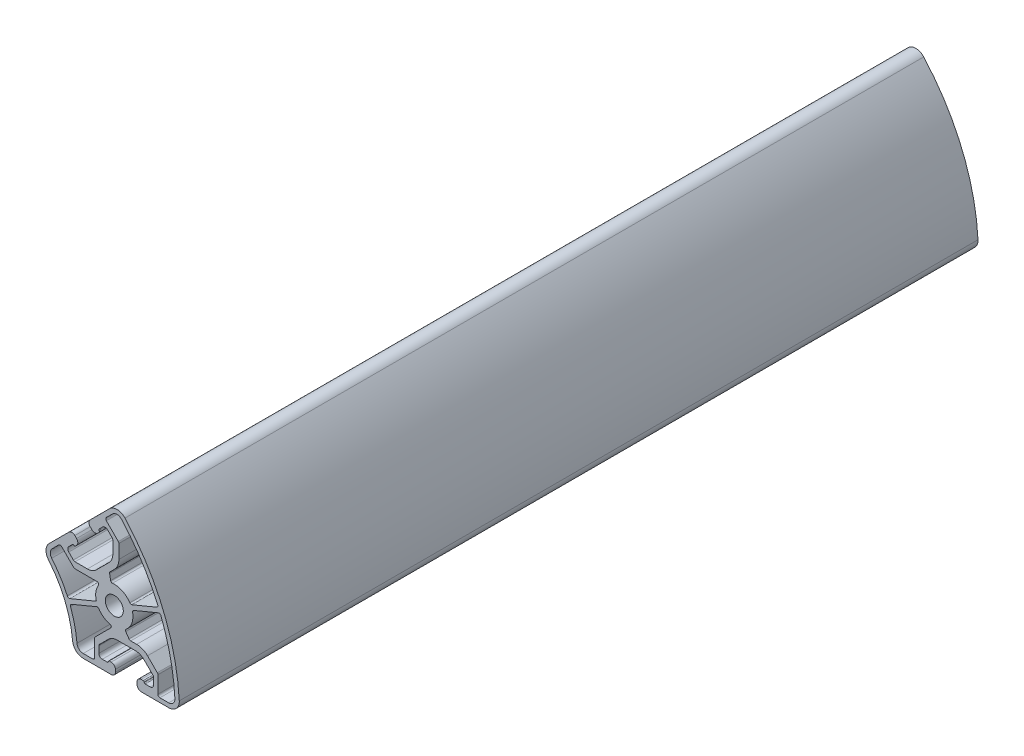
from build123d import *

# Parameters (mm, degrees)
SKETCH1_R      = 3.378193244
EXTRUDE1_DEPTH = 300


with BuildPart() as part:
    # Sketch1 → Extrude1 (new body)
    with BuildSketch(Plane.XY):
        with BuildLine():
            Line((-17.04042372, 15.431408639), (-24.485570149, 7.990664768))
            ThreePointArc((-24.485570149, 7.990664768), (-25.653755155, 5.34518984), (-24.733349861, 2.603648687))
            ThreePointArc((-24.733349861, 2.603648687), (-18.529607307, -7.672004621), (-15.653778055, -19.325548231))
            ThreePointArc((-15.653778055, -19.325548231), (-14.366806417, -21.915316136), (-11.67045068, -22.960715361))
            Line((-11.67045068, -22.960715361), (-1.144536244, -22.960715361))
            ThreePointArc((-1.144536244, -22.960715361), (-0.031123661, -22.499524769), (0.430066931, -21.386112187))
            Line((0.430066931, -21.386112187), (0.430066931, -20.471826472))
            ThreePointArc((0.430066931, -20.471826472), (-0.031123661, -19.35841389), (-1.144536244, -18.897223298))
            Line((-1.144536244, -18.897223298), (-1.851013704, -18.897223298))
            ThreePointArc((-1.851013704, -18.897223298), (-2.114950893, -19.003860844), (-2.230734754, -19.263915653))
            Line((-2.230734754, -19.263915653), (-2.231730696, -19.292435705))
            ThreePointArc((-2.231730696, -19.292435705), (-2.347514556, -19.552490514), (-2.611451745, -19.65912806))
            Line((-2.611451745, -19.65912806), (-4.522314022, -19.65912806))
            ThreePointArc((-4.522314022, -19.65912806), (-5.420227395, -19.287200163), (-5.792155291, -18.38928679))
            Line((-5.792155291, -18.38928679), (-5.792155291, -15.94919425))
            ThreePointArc((-5.792155291, -15.94919425), (-5.724492654, -15.609031199), (-5.531805764, -15.320654889))
            Line((-5.531805764, -15.320654889), (-2.245416253, -12.034265378))
            ThreePointArc((-2.245416253, -12.034265378), (-0.704662825, -11.004766851), (1.112779762, -10.643255044))
            Line((1.112779762, -10.643255044), (7.874338227, -10.643255044))
            ThreePointArc((7.874338227, -10.643255044), (9.691780814, -11.004766851), (11.232534242, -12.034265378))
            Line((11.232534242, -12.034265378), (14.518923752, -15.320654889))
            ThreePointArc((14.518923752, -15.320654889), (14.711610642, -15.609031199), (14.77927328, -15.94919425))
            Line((14.77927328, -15.94919425), (14.77927328, -18.38928679))
            ThreePointArc((14.77927328, -18.38928679), (14.407345383, -19.287200163), (13.50943201, -19.65912806))
            Line((13.50943201, -19.65912806), (11.598569733, -19.65912806))
            ThreePointArc((11.598569733, -19.65912806), (11.334632545, -19.552490514), (11.218848684, -19.292435705))
            Line((11.218848684, -19.292435705), (11.217852742, -19.263915653))
            ThreePointArc((11.217852742, -19.263915653), (11.102068882, -19.003860844), (10.838131693, -18.897223298))
            Line((10.838131693, -18.897223298), (10.068162169, -18.897223298))
            ThreePointArc((10.068162169, -18.897223298), (8.994767984, -19.373315236), (8.557051058, -20.462921818))
            Line((8.557051058, -20.462921818), (8.557051058, -21.377207532))
            ThreePointArc((8.557051058, -21.377207532), (8.99769069, -22.469479665), (10.068162169, -22.960715361))
            Line((10.068162169, -22.960715361), (20.406917219, -22.960715361))
            ThreePointArc((20.406917219, -22.960715361), (23.309060919, -21.713452534), (24.401336641, -18.749496331))
            ThreePointArc((24.401336641, -18.749496331), (18.427837191, 7.629867689), (4.005478547, 30.511063307))
            ThreePointArc((4.005478547, 30.511063307), (1.137680997, 31.835389487), (-1.796738453, 30.666079815))
            Line((-1.796738453, 30.666079815), (-9.109504077, 23.357638469))
            ThreePointArc((-9.109504077, 23.357638469), (-9.519412208, 22.253465918), (-9.058959046, 21.169397386))
            Line((-9.058959046, 21.169397386), (-8.412652649, 20.522708582))
            ThreePointArc((-8.412652649, 20.522708582), (-7.332808217, 20.061433598), (-6.237031206, 20.483466005))
            Line((-6.237031206, 20.483466005), (-5.692419534, 21.027755629))
            ThreePointArc((-5.692419534, 21.027755629), (-5.581114397, 21.28975863), (-5.683050759, 21.555546861))
            Line((-5.683050759, 21.555546861), (-5.702507071, 21.576423576))
            ThreePointArc((-5.702507071, 21.576423576), (-5.804443433, 21.842211807), (-5.693138296, 22.104214808))
            Line((-5.693138296, 22.104214808), (-4.341555064, 23.454998805))
            ThreePointArc((-4.341555064, 23.454998805), (-3.443531731, 23.826661124), (-2.545728396, 23.454467682))
            Line((-2.545728396, 23.454467682), (-0.820832785, 21.728551481))
            ThreePointArc((-0.820832785, 21.728551481), (-0.628231192, 21.440118195), (-0.560669162, 21.099935148))
            Line((-0.560669162, 21.099935148), (-0.562043724, 16.452278734))
            ThreePointArc((-0.562043724, 16.452278734), (-0.924093031, 14.634943145), (-1.954047197, 13.094494262))
            Line((-1.954047197, 13.094494262), (-6.736604871, 8.314764671))
            ThreePointArc((-6.736604871, 8.314764671), (-8.27766271, 7.285721873), (-10.095212136, 6.924747597))
            Line((-10.095212136, 6.924747597), (-14.74286855, 6.926122159))
            ThreePointArc((-14.74286855, 6.926122159), (-15.083011574, 6.993885398), (-15.371330884, 7.186657568))
            Line((-15.371330884, 7.186657568), (-17.096226495, 8.91257377))
            ThreePointArc((-17.096226495, 8.91257377), (-17.467888814, 9.810597103), (-17.095695372, 10.708400437))
            Line((-17.095695372, 10.708400437), (-15.74411214, 12.059184434))
            ThreePointArc((-15.74411214, 12.059184434), (-15.482043347, 12.170334575), (-15.216315459, 12.068241015))
            Line((-15.216315459, 12.068241015), (-15.195450256, 12.048772358))
            ThreePointArc((-15.195450256, 12.048772358), (-14.929722367, 11.946678798), (-14.667653575, 12.057828939))
            Line((-14.667653575, 12.057828939), (-14.167950848, 12.557236175))
            ThreePointArc((-14.167950848, 12.557236175), (-13.70643098, 13.67051231), (-14.167292256, 14.784061242))
            Line((-14.167292256, 14.784061242), (-14.813598652, 15.430750047))
            ThreePointArc((-14.813598652, 15.430750047), (-15.926874787, 15.892269915), (-17.04042372, 15.431408639))
        make_face()
        Circle(SKETCH1_R, mode=Mode.SUBTRACT)
        with BuildLine():
            Line((-8.130757209, -21.370715361), (-11.673344577, -21.370715361))
            ThreePointArc((-11.673344577, -21.370715361), (-13.258626812, -20.755471896), (-14.013837102, -19.23189003))
            ThreePointArc((-14.013837102, -19.23189003), (-14.872264525, -13.783171952), (-16.443322189, -8.495714704))
            ThreePointArc((-16.443322189, -8.495714704), (-16.427294419, -7.927487377), (-16.021576747, -7.529326159))
            Line((-16.021576747, -7.529326159), (-6.607938261, -3.630069426))
            ThreePointArc((-6.607938261, -3.630069426), (-6.179406749, -3.609440138), (-5.835565156, -3.866028881))
            ThreePointArc((-5.835565156, -3.866028881), (-4.011915729, -5.736247221), (-1.629593619, -6.807673952))
            ThreePointArc((-1.629593619, -6.807673952), (-1.166319275, -7.252659472), (-1.328408234, -7.874240038))
            Line((-1.328408234, -7.874240038), (-7.148158363, -13.693990167))
            ThreePointArc((-7.148158363, -13.693990167), (-7.312905654, -13.940551912), (-7.370757209, -14.23139132))
            Line((-7.370757209, -14.23139132), (-7.370757209, -20.610715361))
            ThreePointArc((-7.370757209, -20.610715361), (-7.593356055, -21.148116515), (-8.130757209, -21.370715361))
        make_face(mode=Mode.SUBTRACT)
        with BuildLine():
            Line((20.418391526, -21.370715361), (17.138195039, -21.370715361))
            ThreePointArc((17.138195039, -21.370715361), (16.600793885, -21.148116515), (16.378195039, -20.610715361))
            Line((16.378195039, -20.610715361), (16.378195039, -14.25171132))
            ThreePointArc((16.378195039, -14.25171132), (16.320343484, -13.960871912), (16.155596193, -13.714310167))
            Line((16.155596193, -13.714310167), (12.486038977, -10.044752951))
            ThreePointArc((12.486038977, -10.044752951), (10.615478832, -8.794884621), (8.409002698, -8.35598923))
            Line((8.409002698, -8.35598923), (6.154378538, -8.35598923))
            ThreePointArc((6.154378538, -8.35598923), (5.800842447, -8.268753652), (5.528466848, -8.027073394))
            Line((5.528466848, -8.027073394), (4.315683522, -6.266169144))
            ThreePointArc((4.315683522, -6.266169144), (4.209920366, -5.81697222), (4.436221584, -5.414788829))
            ThreePointArc((4.436221584, -5.414788829), (6.594459284, -2.348000586), (6.860062932, 1.392672456))
            ThreePointArc((6.860062932, 1.392672456), (6.921760014, 1.817240818), (7.239364661, 2.105671246))
            Line((7.239364661, 2.105671246), (16.508429277, 5.945043521))
            ThreePointArc((16.508429277, 5.945043521), (17.097304243, 5.94201939), (17.507242876, 5.519250909))
            ThreePointArc((17.507242876, 5.519250909), (21.115407947, -6.478770082), (22.765211001, -18.898492815))
            ThreePointArc((22.765211001, -18.898492815), (22.122756948, -20.638627135), (20.418391526, -21.370715361))
        make_face(mode=Mode.SUBTRACT)
        with BuildLine():
            Line((-19.787590021, 9.363765211), (-15.275025713, 4.851200903))
            ThreePointArc((-15.275025713, 4.851200903), (-15.028463968, 4.686453612), (-14.73762456, 4.628602057))
            Line((-14.73762456, 4.628602057), (-6.507254998, 4.628602057))
            ThreePointArc((-6.507254998, 4.628602057), (-5.953116962, 4.303692426), (-5.966049114, 3.661455717))
            ThreePointArc((-5.966049114, 3.661455717), (-6.933511551, 0.962505882), (-6.737797651, -1.897915388))
            Line((-6.737797651, -1.897915388), (-16.652389322, -6.004673724))
            ThreePointArc((-16.652389322, -6.004673724), (-17.220965814, -6.009958748), (-17.634081109, -5.619263328))
            ThreePointArc((-17.634081109, -5.619263328), (-20.26130976, -0.76628586), (-23.507186823, 3.696673112))
            ThreePointArc((-23.507186823, 3.696673112), (-24.050030989, 5.308183117), (-23.363649832, 6.86398683))
            Line((-23.363649832, 6.86398683), (-20.862233366, 9.363924126))
            ThreePointArc((-20.862233366, 9.363924126), (-20.324878788, 9.586364049), (-19.787590021, 9.363765211))
        make_face(mode=Mode.SUBTRACT)
        with BuildLine():
            Line((-2.989101394, 27.22648713), (-0.664655277, 29.549558726))
            ThreePointArc((-0.664655277, 29.549558726), (1.058380877, 30.23655296), (2.742895641, 29.459877564))
            ThreePointArc((2.742895641, 29.459877564), (10.354016898, 19.511168226), (16.282595001, 8.47676992))
            ThreePointArc((16.282595001, 8.47676992), (16.291564751, 7.888035719), (15.877338122, 7.469580564))
            Line((15.877338122, 7.469580564), (6.607938261, 3.630069426))
            ThreePointArc((6.607938261, 3.630069426), (6.179406749, 3.609440138), (5.835565156, 3.866028881))
            ThreePointArc((5.835565156, 3.866028881), (3.002699742, 6.323274014), (-0.691951535, 6.965716264))
            ThreePointArc((-0.691951535, 6.965716264), (-1.136357264, 7.090083742), (-1.37920161, 7.482499777))
            Line((-1.37920161, 7.482499777), (-1.766781632, 9.585214428))
            ThreePointArc((-1.766781632, 9.585214428), (-1.745076748, 9.94870681), (-1.55677385, 10.260379446))
            Line((-1.55677385, 10.260379446), (0.037486183, 11.854639479))
            ThreePointArc((0.037486183, 11.854639479), (1.287354512, 13.725199623), (1.726249904, 15.931675758))
            Line((1.726249904, 15.931675758), (1.726249904, 21.12121334))
            ThreePointArc((1.726249904, 21.12121334), (1.668398349, 21.412052749), (1.503651058, 21.658614494))
            Line((1.503651058, 21.658614494), (-2.989260356, 26.151525907))
            ThreePointArc((-2.989260356, 26.151525907), (-3.211859194, 26.689039448), (-2.989101394, 27.22648713))
        make_face(mode=Mode.SUBTRACT)
    extrude(amount=-EXTRUDE1_DEPTH)


solid = part.part
